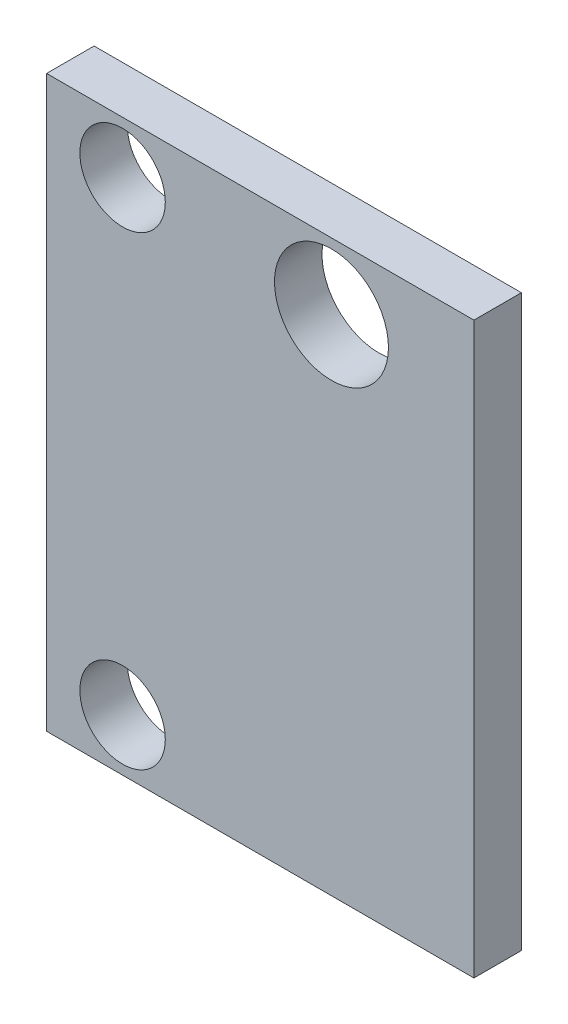
from build123d import *

# Parameters (mm, degrees)
SZKIC1_W                    = 45
SZKIC1_H                    = 60
SZKIC1_R                    = 4.5
DODANIE_WYCI_GNI_CIE1_DEPTH = 5
SZKIC2_R                    = 6
WYTNIJ_WYCI_GNI_CIE1_DEPTH  = 10


with BuildPart() as part:
    # Szkic1 → Dodanie-wyciągnięcie1 (new body)
    with BuildSketch(Plane.XY):
        Rectangle(SZKIC1_W, SZKIC1_H)
        with Locations((-14.5, 24.5)):
            Circle(SZKIC1_R, mode=Mode.SUBTRACT)
        with Locations((-14.5, -24.5)):
            Circle(SZKIC1_R, mode=Mode.SUBTRACT)
    extrude(amount=DODANIE_WYCI_GNI_CIE1_DEPTH)

    # Szkic2 → Wytnij-wyciągnięcie1 (cut)
    with BuildSketch(Plane.XY.offset(5)):
        with Locations((7.5, 23)):
            Circle(SZKIC2_R)
    extrude(amount=-WYTNIJ_WYCI_GNI_CIE1_DEPTH, mode=Mode.SUBTRACT)


solid = part.part
